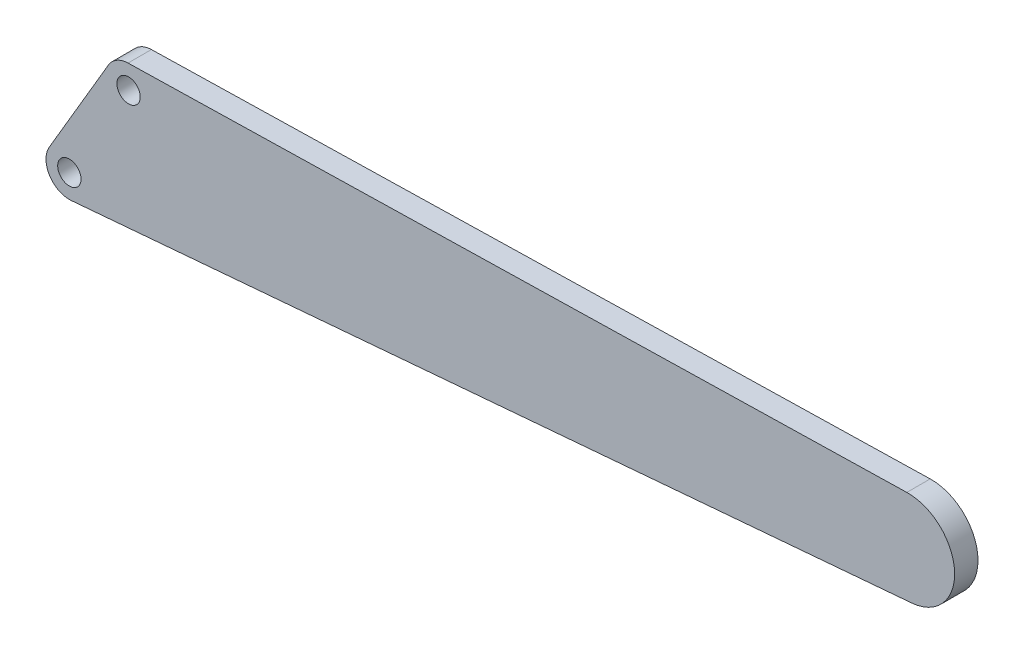
from build123d import *

# Parameters (mm, degrees)
SKETCH3_R           = 1.5
BOSS_EXTRUDE1_DEPTH = 3


with BuildPart() as part:
    # Sketch3 → Boss-Extrude1 (new body)
    with BuildSketch(Plane.XY):
        with BuildLine():
            Line((-10.183601696, -11.414650958), (-2.586802173, 1.519359905))
            ThreePointArc((-2.586802173, 1.519359905), (-1.519531237, 2.586701533), (-0.067601875, 2.999238234))
            Line((-0.067601875, 2.999238234), (99.864796249, 5.251682686))
            ThreePointArc((99.864796249, 5.251682686), (105.991316455, -0.424106412), (100.509855462, -6.725091819))
            Line((100.509855462, -6.725091819), (-7.341871793, -15.923159881))
            ThreePointArc((-7.341871793, -15.923159881), (-10.13472639, -14.533675584), (-10.183601696, -11.414650958))
        make_face()
        with Locations((-7.596799524, -12.934010863)):
            Circle(SKETCH3_R, mode=Mode.SUBTRACT)
        Circle(SKETCH3_R, mode=Mode.SUBTRACT)
    extrude(amount=BOSS_EXTRUDE1_DEPTH)


solid = part.part
